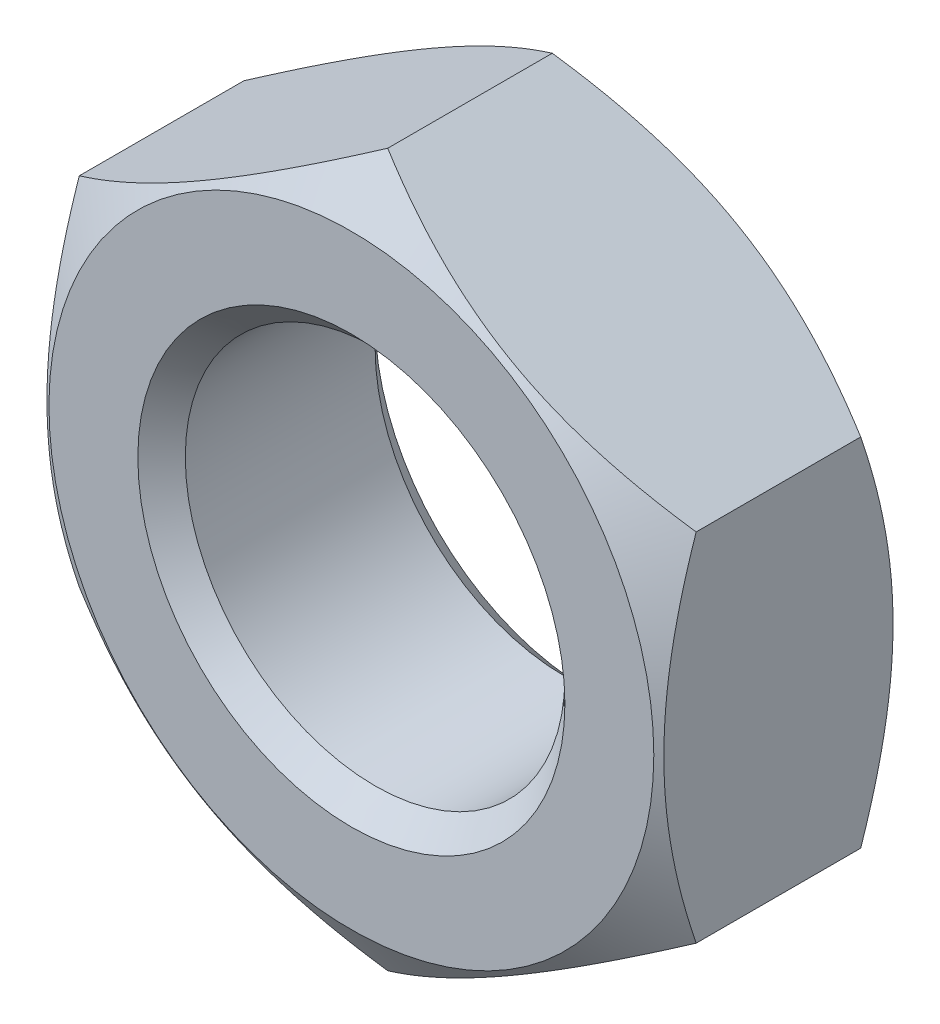
from build123d import *

# Parameters (mm, degrees)
SKETCH_1_R      = 4
EXTRUDE_1_DEPTH = 5
CHAMFER_1_SIZE  = 0.5


with BuildPart() as part:
    # 草图1 → 凸台-拉伸1 (new body)
    with BuildSketch(Plane.XY):
        Polygon((0, 7.505553499), (-6.5, 3.75277675), (-6.5, -3.75277675), (0, -7.505553499), (6.5, -3.75277675), (6.5, 3.75277675), align=None)
        Circle(SKETCH_1_R, mode=Mode.SUBTRACT)
    extrude(amount=EXTRUDE_1_DEPTH)

    # 草图2 → 切除-旋转1 (revolve, cut)
    with BuildSketch(Plane(origin=(0, 0, 0), x_dir=(0, 0, -1), z_dir=(1, 0, 0)), mode=Mode.PRIVATE) as cut_revolve_1_sk:
        Polygon((-4.142378968, 7.640341523), (-5.294673063, 5.938491783), (-5.294673063, 7.640341523), align=None)
    cut_revolve_1 = revolve(cut_revolve_1_sk.sketch.rotate(Axis((0, 0, 5), (0, 0, -1)), 300.000000026), axis=Axis((0, 0, 5), (0, 0, -1)), mode=Mode.SUBTRACT)

    # 镜向2: 切除-旋转1 across plane
    add(cut_revolve_1.mirror(Plane(origin=(0, 0, 2.5), x_dir=(1, 0, 0), z_dir=(0, 0, -1))), mode=Mode.SUBTRACT)

    # 倒角1
    chamfer_1_edges = [part.edges().sort_by_distance(p)[0] for p in [
        (-4, 0, 0),
        (-4, 0, 5),
    ]]
    chamfer(chamfer_1_edges, length=CHAMFER_1_SIZE)


solid = part.part
